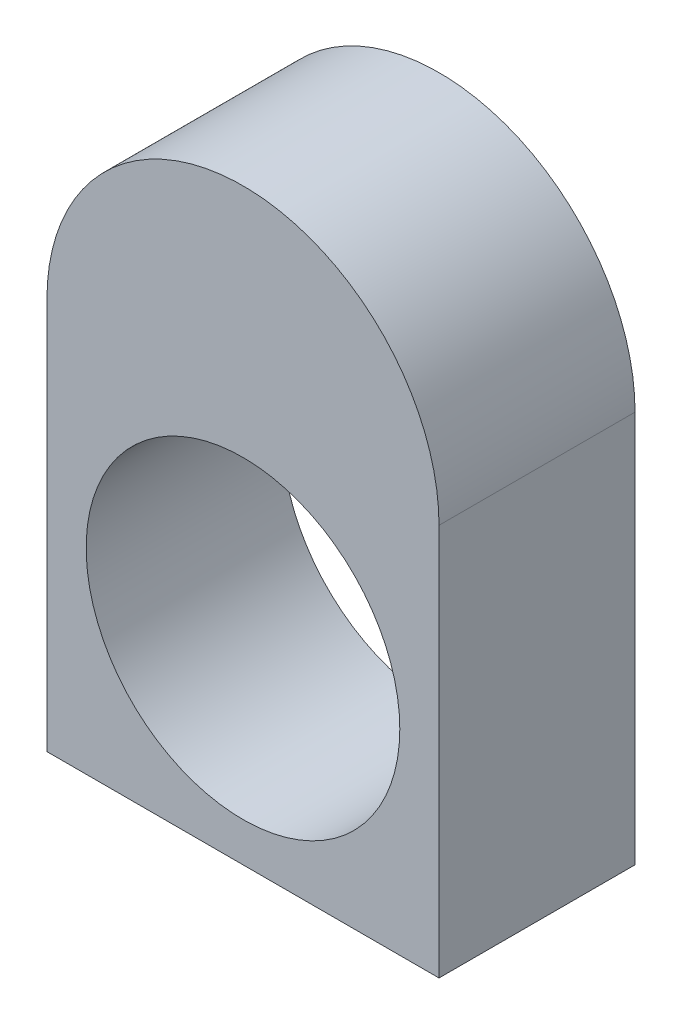
from build123d import *

# Parameters (mm, degrees)
SKETCH2_W           = 2
SKETCH2_H           = 2
BOSS_EXTRUDE1_DEPTH = 1
SKETCH3_R           = 1
BOSS_EXTRUDE2_DEPTH = 1
SKETCH1_R           = 0.8
CUT_EXTRUDE1_DEPTH  = 1


with BuildPart() as part:
    # Sketch2 → Boss-Extrude1 (new body)
    with BuildSketch(Plane.XY):
        Rectangle(SKETCH2_W, SKETCH2_H)
    extrude(amount=-BOSS_EXTRUDE1_DEPTH)

    # Sketch3 → Boss-Extrude2 (add)
    with BuildSketch(Plane.XY):
        with Locations((0, 1)):
            Circle(SKETCH3_R)
    extrude(amount=-BOSS_EXTRUDE2_DEPTH)

    # Sketch1 → Cut-Extrude1 (cut)
    with BuildSketch(Plane.XY):
        Circle(SKETCH1_R)
    extrude(amount=-CUT_EXTRUDE1_DEPTH, mode=Mode.SUBTRACT)


solid = part.part
